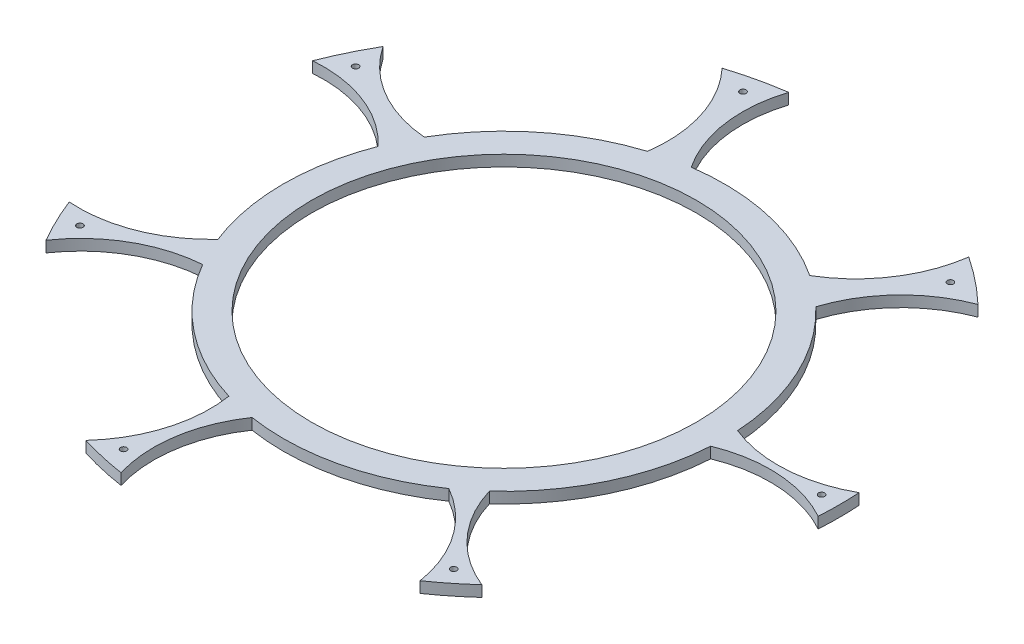
from build123d import *

# Parameters (mm, degrees)
SKETCH1_R           = 63.5
SKETCH1_R_2         = 55.372
BOSS_EXTRUDE1_DEPTH = 3.175
BOSS_EXTRUDE2_DEPTH = 3.175
SKETCH37_R          = 0.889
CUT_EXTRUDE19_DEPTH = 136.856626854
CIRPATTERN7_COUNT   = 7


with BuildPart() as part:
    # Sketch1 → Boss-Extrude1 (new body)
    with BuildSketch(Plane(origin=(0, 0, 0), x_dir=(1, 0, 0), z_dir=(0, 1, 0))):
        with Locations(Location((0, 0, 0), (0, 0, 270))):
            Circle(SKETCH1_R)
        with Locations(Location((0, 0, 0), (0, 0, 270))):
            Circle(SKETCH1_R_2, mode=Mode.SUBTRACT)
    extrude(amount=BOSS_EXTRUDE1_DEPTH)

    # Sketch2 → Boss-Extrude2 (add)
    with BuildSketch(Plane(origin=(0, 0, 0), x_dir=(1, 0, 0), z_dir=(0, 1, 0))):
        with BuildLine():
            ThreePointArc((63.3815597, 3.87658226), (63.5, 0), (63.3815597, -3.87658226))
            ThreePointArc((63.3815597, -3.87658226), (80.090490582, -1.128517213), (96.339970744, -5.892405036))
            ThreePointArc((96.339970744, -5.892405036), (96.52, 0), (96.339970744, 5.892405036))
            ThreePointArc((96.339970744, 5.892405036), (80.090490582, 1.128517213), (63.3815597, 3.87658226))
        make_face()
        with BuildLine():
            ThreePointArc((-8.955065497, 62.865386358), (-15.008770651, 78.67971172), (-13.611699556, 95.555387264))
            ThreePointArc((-13.611699556, 95.555387264), (-21.477720545, 94.100042084), (-29.19621118, 91.998324184))
            ThreePointArc((-29.19621118, 91.998324184), (-20.615412412, 77.400032324), (-19.208033671, 60.525213279))
            ThreePointArc((-19.208033671, 60.525213279), (-14.130079306, 61.907922424), (-8.955065497, 62.865386358))
        make_face()
        with BuildLine():
            ThreePointArc((64.985862756, -71.364893623), (51.087579034, -61.691324359), (42.753857076, -46.95058791))
            ThreePointArc((42.753857076, -46.95058791), (39.591602418, -49.646299137), (36.25981044, -52.129417289))
            ThreePointArc((36.25981044, -52.129417289), (48.776538257, -63.53431788), (55.114911869, -79.236714279))
            ThreePointArc((55.114911869, -79.236714279), (60.179235675, -75.462374688), (64.985862756, -71.364893623))
        make_face()
        with BuildLine():
            ThreePointArc((-14.861314783, -95.36902916), (-16.037370419, -78.4765123), (-9.777180778, -62.742782342))
            ThreePointArc((-9.777180778, -62.742782342), (-14.130079306, -61.907922424), (-18.414137508, -60.77145333))
            ThreePointArc((-18.414137508, -60.77145333), (-19.600511119, -77.663248687), (-27.989489013, -92.372609061))
            ThreePointArc((-27.989489013, -92.372609061), (-21.477720545, -94.100042084), (-14.861314783, -95.36902916))
        make_face()
        with BuildLine():
            ThreePointArc((-83.618837729, -48.207887082), (-71.195081366, -36.701779549), (-55.012393243, -31.715715185))
            ThreePointArc((-55.012393243, -31.715715185), (-57.211523112, -27.551617434), (-59.096010784, -23.235995986))
            ThreePointArc((-59.096010784, -23.235995986), (-73.084013888, -32.77937075), (-89.825936391, -35.318713899))
            ThreePointArc((-89.825936391, -35.318713899), (-86.96151513, -41.8784585), (-83.618837729, -48.207887082))
        make_face()
        with BuildLine():
            ThreePointArc((-89.979187785, 34.926439348), (-73.226344714, 32.460170557), (-59.196834069, 22.977920624))
            ThreePointArc((-59.196834069, 22.977920624), (-57.211523112, 27.551617434), (-54.87348409, 31.955449361))
            ThreePointArc((-54.87348409, 31.955449361), (-71.034262424, 37.012076334), (-83.407695816, 48.572283029))
            ThreePointArc((-83.407695816, 48.572283029), (-86.96151513, 41.8784585), (-89.979187785, 34.926439348))
        make_face()
        with BuildLine():
            ThreePointArc((53.3732562, 80.420183553), (47.378936921, 64.583253007), (35.113984342, 52.908015495))
            ThreePointArc((35.113984342, 52.908015495), (39.591602418, 49.646299137), (43.767904494, 46.006744465))
            ThreePointArc((43.767904494, 46.006744465), (52.421210722, 60.562173831), (66.52721483, 69.930251586))
            ThreePointArc((66.52721483, 69.930251586), (60.179235675, 75.462374688), (53.3732562, 80.420183553))
        make_face()
    extrude(amount=BOSS_EXTRUDE2_DEPTH)

    # Sketch37 → Cut-Extrude19 (cut, through all)
    with BuildSketch(Plane(origin=(0, 3.175, 0), x_dir=(1, 0, 0), z_dir=(0, 1, 0))):
        with Locations(Location((91.44, 0, 0), (0, 0, 270))):
            Circle(SKETCH37_R)
    cut_extrude19 = extrude(amount=-CUT_EXTRUDE19_DEPTH, mode=Mode.SUBTRACT)

    # CirPattern7: Cut-Extrude19 ×7 about axis
    cirpattern7_axis = Axis((0, 0, 0), (0, 1, 0))
    for i in range(1, CIRPATTERN7_COUNT):
        add(cut_extrude19.rotate(cirpattern7_axis, i * 360 / CIRPATTERN7_COUNT), mode=Mode.SUBTRACT)


solid = part.part
